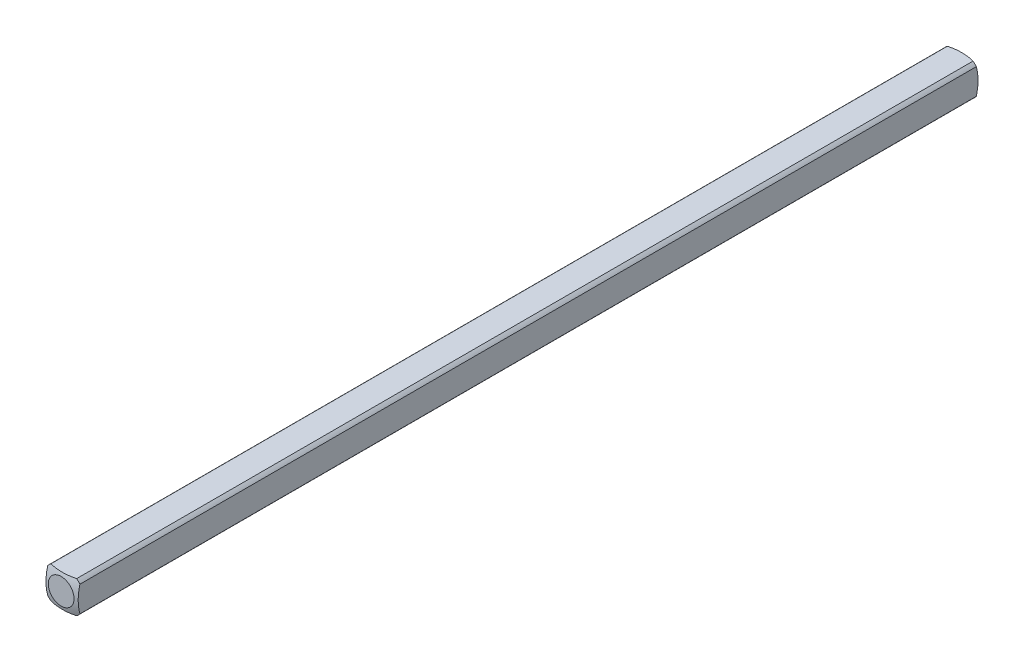
from build123d import *

# Parameters (mm, degrees)
SKETCH1_W           = 3.175
SKETCH1_H           = 3.175
BOSS_EXTRUDE1_DEPTH = 44.45
SKETCH2_OUTSIDE_W   = 14.112
SKETCH2_OUTSIDE_H   = 14.111
SKETCH2_OUTSIDE_R   = 2.032
CUT_EXTRUDE1_DEPTH  = 45.506660316


with BuildPart() as part:
    # Sketch1 → Boss-Extrude1 (new body)
    with BuildSketch(Plane.XY):
        Rectangle(SKETCH1_W, SKETCH1_H)
    extrude(amount=BOSS_EXTRUDE1_DEPTH)

    # Sketch2 outside → Cut-Extrude1 (cut, through all)
    with BuildSketch(Plane(origin=(0, 0, 0), x_dir=(-1, 0, 0), z_dir=(0, 0, -1))):
        with Locations((0, -0.0005)):
            Rectangle(SKETCH2_OUTSIDE_W, SKETCH2_OUTSIDE_H)
        Circle(SKETCH2_OUTSIDE_R, mode=Mode.SUBTRACT)
    extrude(amount=-CUT_EXTRUDE1_DEPTH, mode=Mode.SUBTRACT)

    # Sketch3 → Cut-Revolve1 (revolve, cut)
    with BuildSketch(Plane(origin=(0, 0, 0), x_dir=(1, 0, 0), z_dir=(0, 1, 0))):
        with BuildLine():
            Line((-5.053685963, -4.40273269), (-5.053685963, 5.740530545))
            Line((-5.053685963, 5.740530545), (0, 5.740530545))
            Line((0, 5.740530545), (0, 0.160877736))
            ThreePointArc((0, 0.160877736), (-3.404639553, -1.148866368), (-5.053685963, -4.40273269))
        make_face()
    revolve(axis=Axis((0, 0, 44.45), (0, 0, -1)), mode=Mode.SUBTRACT)

    # Mirror1: part across plane


with BuildPart() as part_1:
    add(part.part)
    add(part.part.mirror(Plane(origin=(0, 0, 44.45), x_dir=(1, 0, 0), z_dir=(0, 0, -1))))


solid = part_1.part
